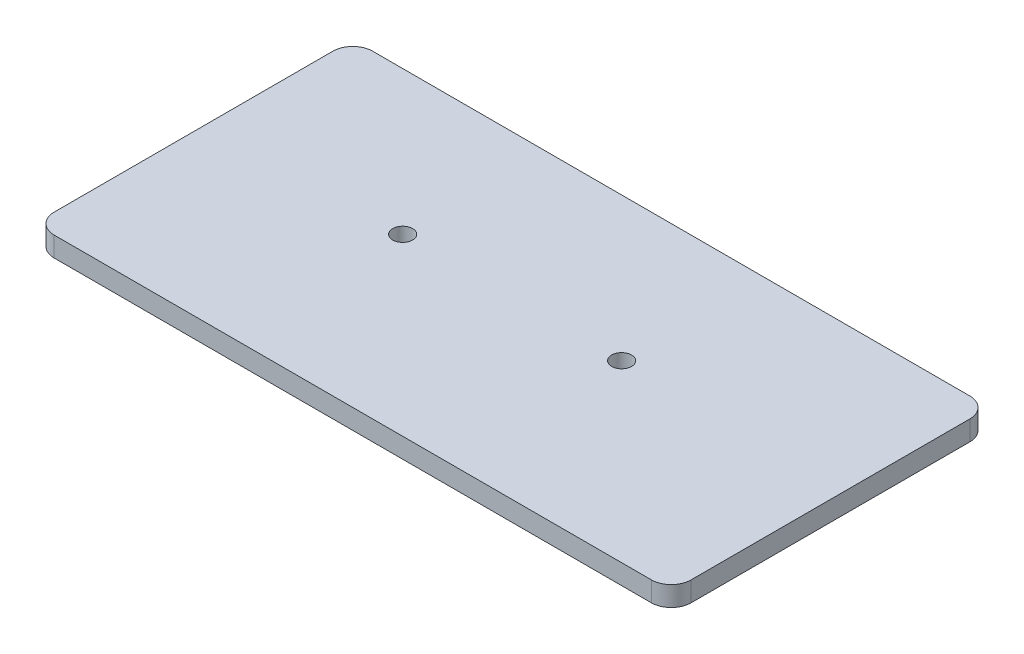
from build123d import *

# Parameters (mm, degrees)
SKETCH1_W                   = 203.2
SKETCH1_H                   = 101.6
BOSS_EXTRUDE1_DEPTH         = 6.35
F_1_4_0_25_DIAMETER_HOLE1_D = 6.35
FILLET1_R                   = 6.35


with BuildPart() as part:
    # Sketch1 → Boss-Extrude1 (new body)
    with BuildSketch(Plane(origin=(0, 0, 0), x_dir=(1, 0, 0), z_dir=(0, 1, 0))):
        with Locations((101.6, 50.8)):
            Rectangle(SKETCH1_W, SKETCH1_H)
    extrude(amount=BOSS_EXTRUDE1_DEPTH)

    # 1/4 (0.25) Diameter Hole1 (through all)
    with Locations(Plane(origin=(0, 6.35, 0), x_dir=(1, 0, 0), z_dir=(0, 1, 0))):
        with Locations((61.726765383, 55.793470503), (131.576765383, 55.793470503)):
            Hole(F_1_4_0_25_DIAMETER_HOLE1_D / 2)

    # Fillet1
    fillet1_edges = [part.edges().sort_by_distance(p)[0] for p in [
        (0, 3.175, -101.6),
        (203.2, 3.175, -101.6),
        (203.2, 3.175, 0),
        (0, 3.175, 0),
    ]]
    fillet(fillet1_edges, radius=FILLET1_R)


solid = part.part
